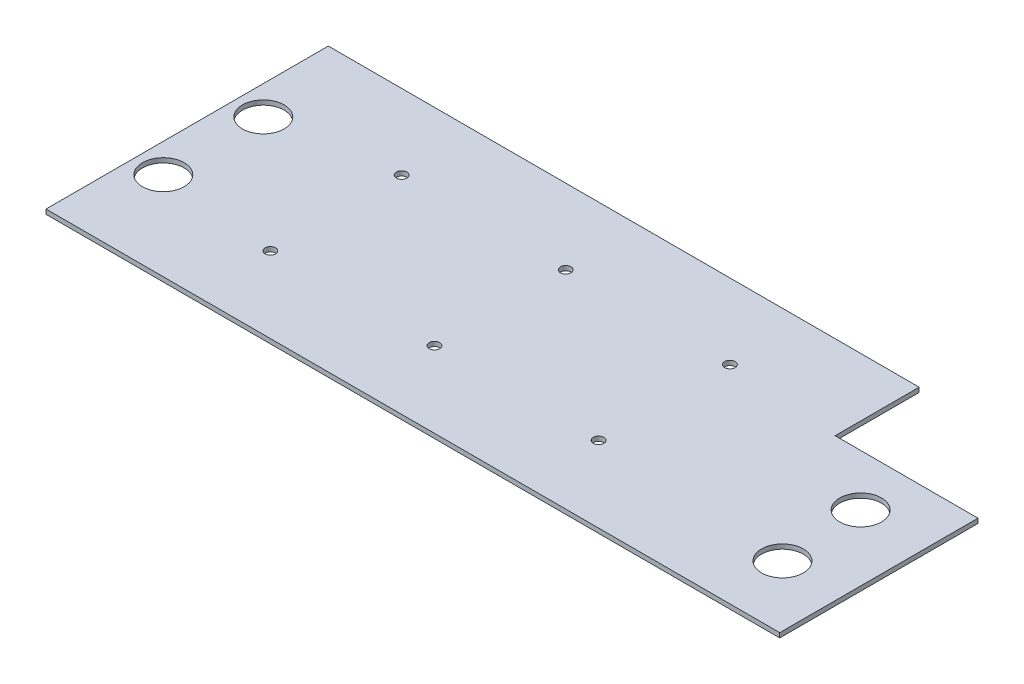
from build123d import *

# Parameters (mm, degrees)
BOSS_EXTRUDE1_DEPTH     = 3.5
CUT_EXTRUDE1_DEPTH      = 599.744260933
CUT_EXTRUDE1_DEPTH_BACK = 599.744260933
SKETCH2_R               = 4
SKETCH3_R               = 15.875
CUT_EXTRUDE2_DEPTH      = 10


with BuildPart() as part:
    # Sketch1 → Boss-Extrude1 (new body)
    with BuildSketch(Plane(origin=(0, 0, 0), x_dir=(1, 0, 0), z_dir=(0, 1, 0))):
        Polygon((0, 0), (0, 215), (450, 215), (450, 151), (558.8, 151), (558.8, 0), align=None)
    extrude(amount=BOSS_EXTRUDE1_DEPTH)

    # Sketch2 → Cut-Extrude1 (cut, two sides: drawn at the far end of the back side and taken through both)
    with BuildSketch(Plane(origin=(0, 3.5, 0), x_dir=(1, 0, 0), z_dir=(0, 1, 0)).offset(-CUT_EXTRUDE1_DEPTH_BACK)):
        with Locations((113, 157.85)):
            Circle(SKETCH2_R)
        with Locations((238, 157.85)):
            Circle(SKETCH2_R)
        with Locations((363, 157.85)):
            Circle(SKETCH2_R)
        with Locations((363, 57.85)):
            Circle(SKETCH2_R)
        with Locations((238, 57.85)):
            Circle(SKETCH2_R)
        with Locations((113, 57.85)):
            Circle(SKETCH2_R)
    extrude(amount=CUT_EXTRUDE1_DEPTH + CUT_EXTRUDE1_DEPTH_BACK, mode=Mode.SUBTRACT)

    # Sketch3 → Cut-Extrude2 (cut)
    with BuildSketch(Plane(origin=(0, 3.5, 0), x_dir=(1, 0, 0), z_dir=(0, 1, 0))):
        with Locations((21.977158482, 143.521297983)):
            Circle(SKETCH3_R)
        with Locations((22.025, 67.321313002)):
            Circle(SKETCH3_R)
        with Locations((512.5174446, 48.349661731)):
            Circle(SKETCH3_R)
        with Locations((508.667649246, 111.732854107)):
            Circle(SKETCH3_R)
    extrude(amount=-CUT_EXTRUDE2_DEPTH, mode=Mode.SUBTRACT)


solid = part.part
